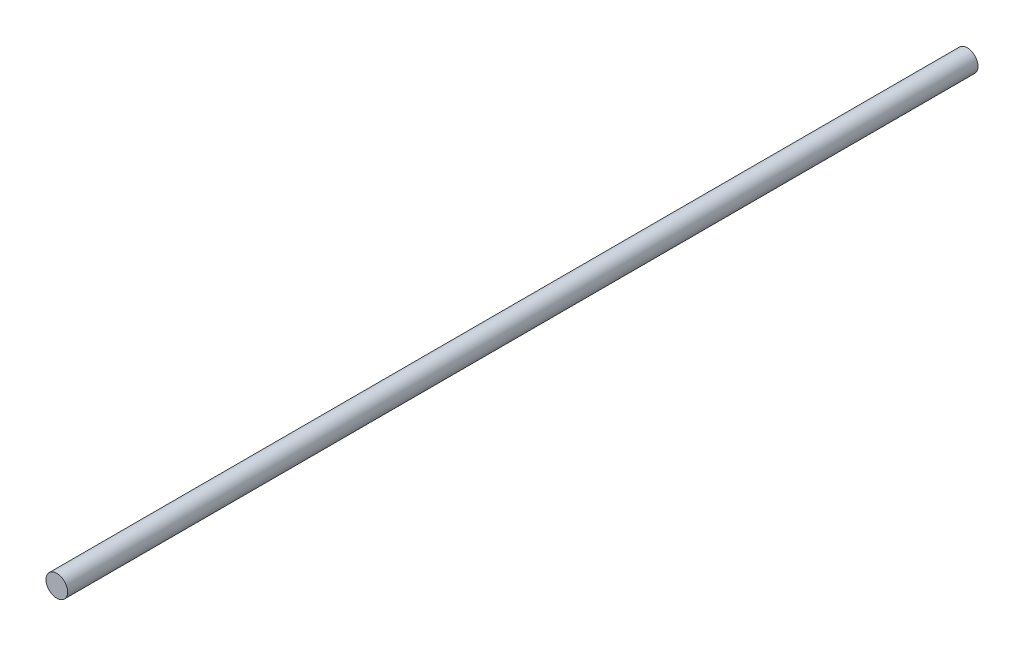
from build123d import *

# Parameters (mm, degrees)
SKETCH1_R           = 4
BOSS_EXTRUDE1_DEPTH = 337


with BuildPart() as part:
    # Sketch1 → Boss-Extrude1 (new body)
    with BuildSketch(Plane.XY):
        Circle(SKETCH1_R)
    extrude(amount=BOSS_EXTRUDE1_DEPTH)


solid = part.part
